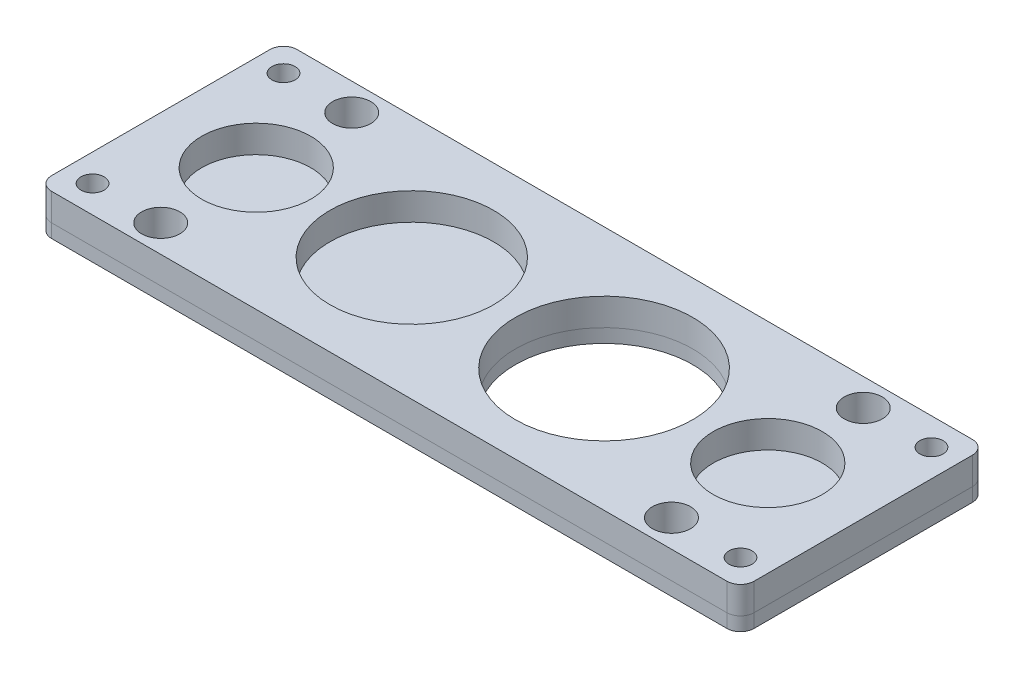
from build123d import *

# Parameters (mm, degrees)
SKETCH2_W           = 103
SKETCH2_H           = 36
SKETCH2_R           = 1.7
SKETCH2_R_2         = 13
BOSS_EXTRUDE1_DEPTH = 2
FILLET1_R           = 2
SKETCH6_W           = 103
SKETCH6_H           = 36
SKETCH6_R           = 1.7
SKETCH6_R_2         = 13
SKETCH6_R_3         = 2.8
SKETCH6_R_4         = 8
SKETCH6_R_5         = 12
BOSS_EXTRUDE3_DEPTH = 4
FILLET2_R           = 2


with BuildPart() as part:
    # Sketch2 → Boss-Extrude1 (new body)
    with BuildSketch(Plane(origin=(0, 0, 0), x_dir=(1, 0, 0), z_dir=(0, 1, 0))):
        with Locations((1.308496413, 2.428579377)):
            Rectangle(SKETCH2_W, SKETCH2_H)
        with Locations(Location((-46.191503587, 16.428579377, 0), (0, 0, 270))):
            Circle(SKETCH2_R, mode=Mode.SUBTRACT)
        with Locations(Location((-46.191503587, -11.571420623, 0), (0, 0, 270))):
            Circle(SKETCH2_R, mode=Mode.SUBTRACT)
        with Locations(Location((48.808496413, 16.428579377, 0), (0, 0, 270))):
            Circle(SKETCH2_R, mode=Mode.SUBTRACT)
        with Locations(Location((48.808496413, -11.571420623, 0), (0, 0, 270))):
            Circle(SKETCH2_R, mode=Mode.SUBTRACT)
        with Locations(Location((14.808496413, 2.428579377, 0), (0, 0, 270))):
            Circle(SKETCH2_R_2, mode=Mode.SUBTRACT)
        with Locations(Location((-36.191503587, 16.428579377, 0), (0, 0, 270))):
            Circle(SKETCH2_R, mode=Mode.SUBTRACT)
        with Locations(Location((-36.191503587, -11.571420623, 0), (0, 0, 270))):
            Circle(SKETCH2_R, mode=Mode.SUBTRACT)
        with Locations(Location((38.808496413, 16.428579377, 0), (0, 0, 270))):
            Circle(SKETCH2_R, mode=Mode.SUBTRACT)
        with Locations(Location((38.690387475, -11.571420623, 0), (0, 0, 270))):
            Circle(SKETCH2_R, mode=Mode.SUBTRACT)
    extrude(amount=BOSS_EXTRUDE1_DEPTH)

    # Fillet1
    fillet1_edges = [part.edges().sort_by_distance(p)[0] for p in [
        (-50.191503587, 1, -20.428579377),
        (52.808496413, 1, -20.428579377),
        (52.808496413, 1, 15.571420623),
        (-50.191503587, 1, 15.571420623),
    ]]
    fillet(fillet1_edges, radius=FILLET1_R)


with BuildPart() as body_2:
    # Sketch6 → Boss-Extrude3 (new body)
    with BuildSketch(Plane(origin=(0, 2, 0), x_dir=(1, 0, 0), z_dir=(0, 1, 0))):
        with Locations((1.308496413, 2.428579377)):
            Rectangle(SKETCH6_W, SKETCH6_H)
        with Locations(Location((-46.191503587, 16.428579377, 0), (0, 0, 270))):
            Circle(SKETCH6_R, mode=Mode.SUBTRACT)
        with Locations(Location((-46.191503587, -11.571420623, 0), (0, 0, 270))):
            Circle(SKETCH6_R, mode=Mode.SUBTRACT)
        with Locations(Location((48.808496413, 16.428579377, 0), (0, 0, 270))):
            Circle(SKETCH6_R, mode=Mode.SUBTRACT)
        with Locations(Location((48.808496413, -11.571420623, 0), (0, 0, 270))):
            Circle(SKETCH6_R, mode=Mode.SUBTRACT)
        with Locations(Location((14.808496413, 2.428579377, 0), (0, 0, 270))):
            Circle(SKETCH6_R_2, mode=Mode.SUBTRACT)
        with Locations(Location((-36.191503587, 16.428579377, 0), (0, 0, 270))):
            Circle(SKETCH6_R_3, mode=Mode.SUBTRACT)
        with Locations(Location((-36.191503587, -11.571420623, 0), (0, 0, 270))):
            Circle(SKETCH6_R_3, mode=Mode.SUBTRACT)
        with Locations(Location((38.808496413, 16.428579377, 0), (0, 0, 270))):
            Circle(SKETCH6_R_3, mode=Mode.SUBTRACT)
        with Locations(Location((38.690387475, -11.571420623, 0), (0, 0, 270))):
            Circle(SKETCH6_R_3, mode=Mode.SUBTRACT)
        with Locations(Location((-36.191503587, 2.428579377, 0), (0, 0, 270))):
            Circle(SKETCH6_R_4, mode=Mode.SUBTRACT)
        with Locations(Location((-13.385120941, 2.428579377, 0), (0, 0, 270))):
            Circle(SKETCH6_R_5, mode=Mode.SUBTRACT)
        with Locations(Location((38.808496413, 2.428579377, 0), (0, 0, 270))):
            Circle(SKETCH6_R_4, mode=Mode.SUBTRACT)
    extrude(amount=BOSS_EXTRUDE3_DEPTH)

    # Fillet2
    fillet2_edges = [body_2.edges().sort_by_distance(p)[0] for p in [
        (-50.191503587, 4, -20.428579377),
        (52.808496413, 4, -20.428579377),
        (52.808496413, 4, 15.571420623),
        (-50.191503587, 4, 15.571420623),
    ]]
    fillet(fillet2_edges, radius=FILLET2_R)


solid = Compound([part.part, body_2.part])
